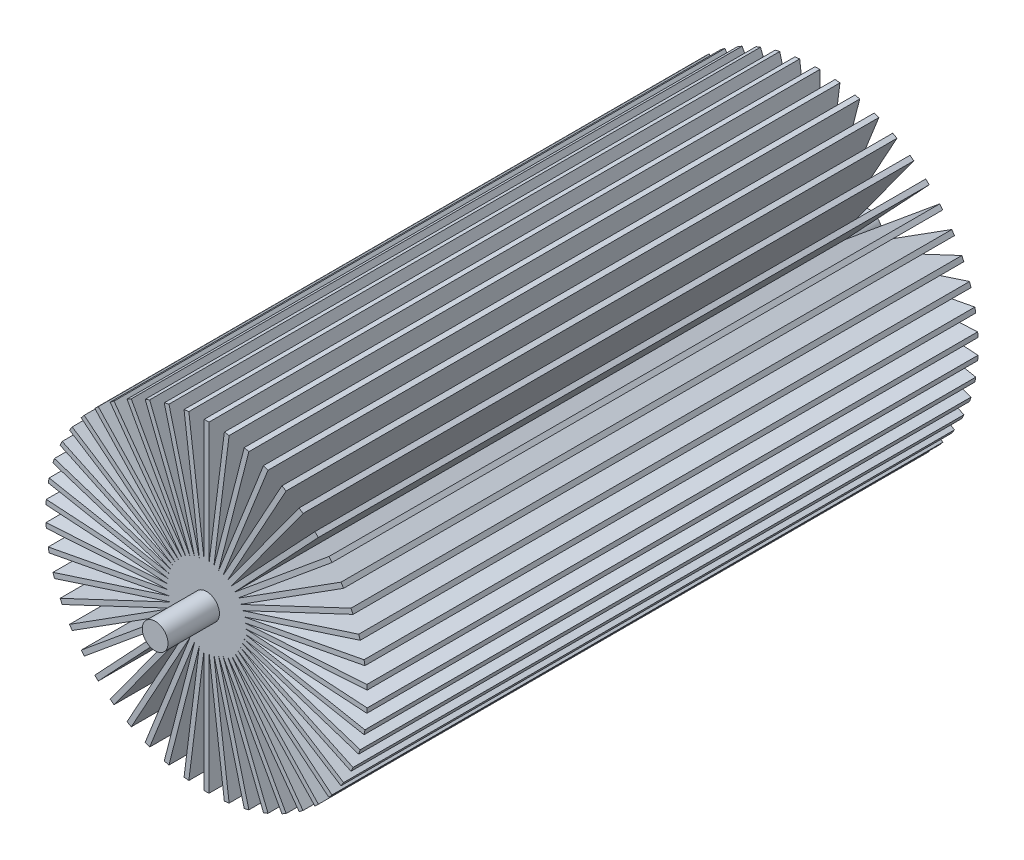
from build123d import *

# Parameters (mm, degrees)
SKETCH4_R           = 4
BOSS_EXTRUDE1_DEPTH = 111
SKETCH6_W           = 1.5
SKETCH6_H           = 50
BOSS_EXTRUDE2_DEPTH = 95
CIRPATTERN1_COUNT   = 50


with BuildPart() as part:
    # Sketch4 → Boss-Extrude1 (new, symmetric)
    with BuildSketch(Plane.XY):
        Circle(SKETCH4_R)
    extrude(amount=BOSS_EXTRUDE1_DEPTH, both=True)

    # Sketch6 → Boss-Extrude2 (add, symmetric)
    with BuildSketch(Plane.XY):
        with Locations((0, 25)):
            Rectangle(SKETCH6_W, SKETCH6_H)
    boss_extrude2 = extrude(amount=BOSS_EXTRUDE2_DEPTH, both=True)

    # CirPattern1: Boss-Extrude2 ×50 about axis
    cirpattern1_axis = Axis((0, 0, 0), (0, 0, 1))
    for i in range(1, CIRPATTERN1_COUNT):
        add(boss_extrude2.rotate(cirpattern1_axis, i * 360 / CIRPATTERN1_COUNT))


solid = part.part
